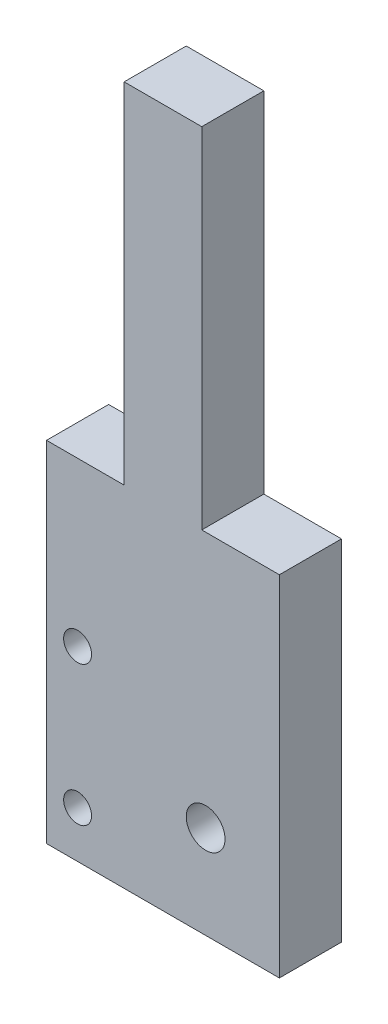
from build123d import *

# Parameters (mm, degrees)
SKETCH1_R           = 2.286
SKETCH1_R_2         = 3.175
BOSS_EXTRUDE1_DEPTH = 10.16


with BuildPart() as part:
    # Sketch1 → Boss-Extrude1 (new body)
    with BuildSketch(Plane.XY):
        Polygon((0, 57.15), (12.7, 57.15), (12.7, 114.3), (25.4, 114.3), (25.4, 57.15), (38.1, 57.15), (38.1, 0), (0, 0), align=None)
        with Locations((5.08, 7.62)):
            Circle(SKETCH1_R, mode=Mode.SUBTRACT)
        with Locations((5.08, 30.48)):
            Circle(SKETCH1_R, mode=Mode.SUBTRACT)
        with Locations((26.035, 15.24)):
            Circle(SKETCH1_R_2, mode=Mode.SUBTRACT)
    extrude(amount=BOSS_EXTRUDE1_DEPTH)


solid = part.part
